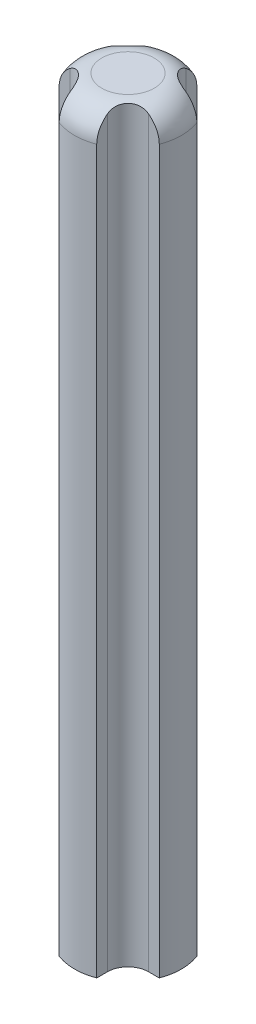
from build123d import *

# Parameters (mm, degrees)
SKETCH1_R           = 3.925
BOSS_EXTRUDE1_DEPTH = 55
FILLET1_R           = 2
SKETCH2_W           = 2.5
SKETCH2_H           = 2.5
CUT_EXTRUDE1_DEPTH  = 56.279392634
CIRPATTERN1_COUNT   = 4
FILLET2_R           = 1.5


with BuildPart() as part:
    # Sketch1 → Boss-Extrude1 (new body)
    with BuildSketch(Plane(origin=(0, 0, 0), x_dir=(1, 0, 0), z_dir=(0, 1, 0))):
        with Locations(Location((0, 0, 0), (0, 0, 270))):
            Circle(SKETCH1_R)
    extrude(amount=BOSS_EXTRUDE1_DEPTH)

    # Fillet1
    fillet1_edges = [part.edges().sort_by_distance(p)[0] for p in [
        (0, 55, -3.925),
    ]]
    fillet(fillet1_edges, radius=FILLET1_R)

    # Sketch2 → Cut-Extrude1 (cut, through all)
    with BuildSketch(Plane(origin=(0, 55, 0), x_dir=(1, 0, 0), z_dir=(0, 1, 0))):
        with Locations((2.628858223, -2.628858223)):
            Rectangle(SKETCH2_W, SKETCH2_H)
    cut_extrude1 = extrude(amount=-CUT_EXTRUDE1_DEPTH, mode=Mode.SUBTRACT)

    # CirPattern1: Cut-Extrude1 ×4 about axis
    cirpattern1_axis = Axis((0, 0, 0), (0, 1, 0))
    for i in range(1, CIRPATTERN1_COUNT):
        add(cut_extrude1.rotate(cirpattern1_axis, i * 360 / CIRPATTERN1_COUNT), mode=Mode.SUBTRACT)

    # Fillet2
    fillet2_edges = [part.edges().sort_by_distance(p)[0] for p in [
        (1.378858223, 27.499921872, -1.378858223),
        (-1.378858223, 27.499921872, -1.378858223),
        (-1.378858223, 27.499921872, 1.378858223),
        (1.378858223, 27.499921872, 1.378858223),
    ]]
    fillet(fillet2_edges, radius=FILLET2_R)


solid = part.part
